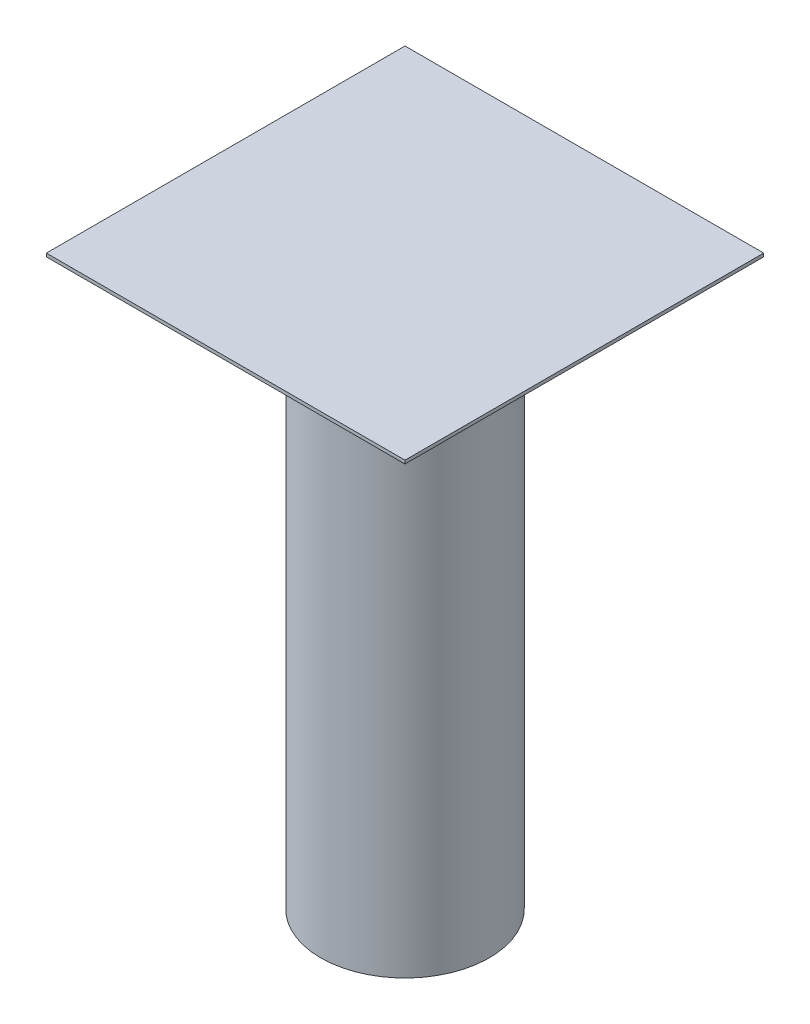
from build123d import *

# Parameters (mm, degrees)
SKETCH1_R           = 25.4
BOSS_EXTRUDE1_DEPTH = 170.1
SKETCH2_R           = 24.65
CUT_EXTRUDE1_DEPTH  = 174.851459585
SKETCH3_W           = 108
SKETCH3_H           = 108
BOSS_EXTRUDE2_DEPTH = 1


with BuildPart() as part:
    # Sketch1 → Boss-Extrude1 (new body)
    with BuildSketch(Plane(origin=(0, 0, 0), x_dir=(1, 0, 0), z_dir=(0, 1, 0))):
        with Locations(Location((0, 0, 0), (0, 0, 270))):
            Circle(SKETCH1_R)
    extrude(amount=BOSS_EXTRUDE1_DEPTH)

    # Sketch2 → Cut-Extrude1 (cut, through all)
    with BuildSketch(Plane(origin=(0, 170.1, 0), x_dir=(1, 0, 0), z_dir=(0, 1, 0))):
        with Locations(Location((0, 0, 0), (0, 0, 270))):
            Circle(SKETCH2_R)
    extrude(amount=-CUT_EXTRUDE1_DEPTH, mode=Mode.SUBTRACT)

    # Sketch3 → Boss-Extrude2 (add)
    with BuildSketch(Plane(origin=(0, 170.1, 0), x_dir=(1, 0, 0), z_dir=(0, 1, 0))):
        Rectangle(SKETCH3_W, SKETCH3_H)
    extrude(amount=BOSS_EXTRUDE2_DEPTH)


solid = part.part
